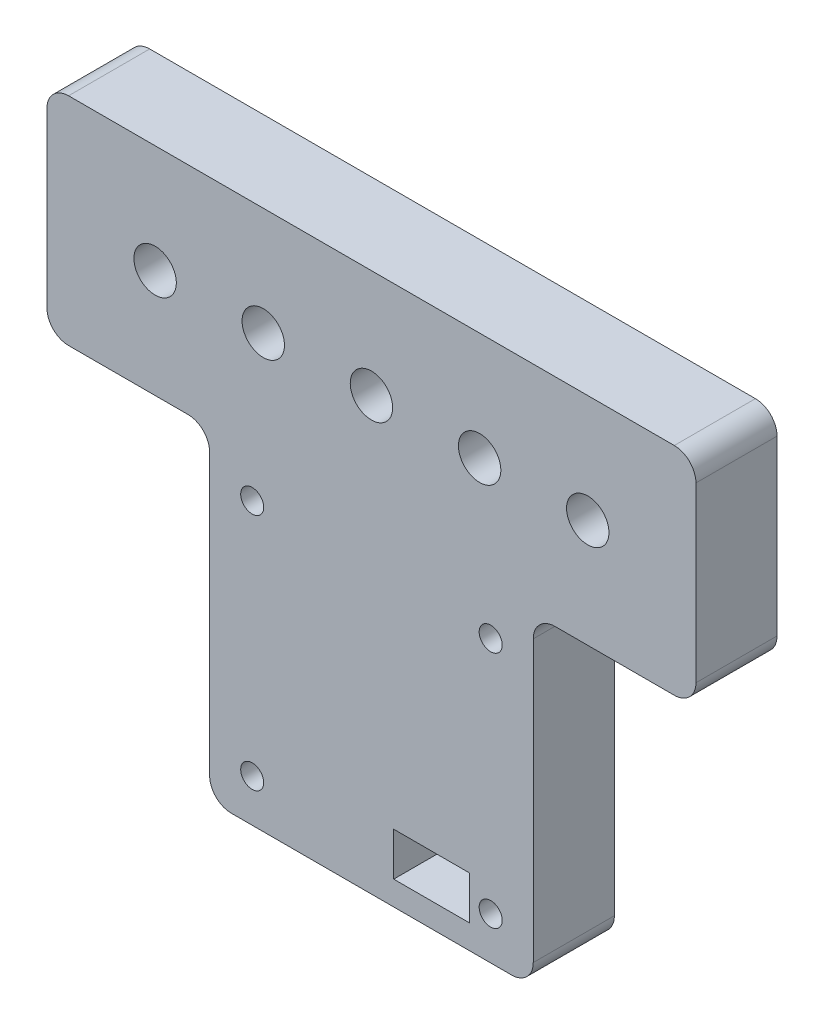
from build123d import *

# Parameters (mm, degrees)
SKETCH1_W                    = 38
SKETCH1_H                    = 38
BOSS_EXTRUDE1_DEPTH          = 9.525
F_36_0_1065_DIAMETER_HOLE2_D = 2.7051
SKETCH7_W                    = 8.89
SKETCH7_H                    = 5.08
CUT_EXTRUDE1_DEPTH           = 29.508343077
SKETCH8_W                    = 76.2
SKETCH8_H                    = 9.525
BOSS_EXTRUDE2_DEPTH          = 25.4
F_9_0_196_DIAMETER_HOLE1_D   = 4.9784
FILLET1_R                    = 2.54


with BuildPart() as part:
    # Sketch1 → Boss-Extrude1 (new body)
    with BuildSketch(Plane(origin=(0, 0, 0), x_dir=(0, 1, 0), z_dir=(0, 0, 1))):
        Rectangle(SKETCH1_W, SKETCH1_H)
    extrude(amount=BOSS_EXTRUDE1_DEPTH)

    # #36 (0.1065) Diameter Hole2 (through all)
    with Locations(Plane.XY.offset(9.525)):
        with Locations((-14, -14), (14, -14), (14, 14), (-14, 14)):
            Hole(F_36_0_1065_DIAMETER_HOLE2_D / 2)

    # Sketch7 → Cut-Extrude1 (cut, through all)
    with BuildSketch(Plane(origin=(0, 0, 0), x_dir=(1, 0, 0), z_dir=(0, 0, -1))):
        with Locations((7.05999991, 13.629999978)):
            Rectangle(SKETCH7_W, SKETCH7_H)
    extrude(amount=-CUT_EXTRUDE1_DEPTH, mode=Mode.SUBTRACT)

    # Sketch8 → Boss-Extrude2 (add)
    with BuildSketch(Plane(origin=(0, 19, 0), x_dir=(-1, 0, 0), z_dir=(0, 1, 0))):
        with Locations((0, 4.7625)):
            Rectangle(SKETCH8_W, SKETCH8_H)
    extrude(amount=BOSS_EXTRUDE2_DEPTH)

    # #9 (0.196) Diameter Hole1 (through all)
    with Locations(Plane(origin=(0, 0, 0), x_dir=(1, 0, 0), z_dir=(0, 0, -1))):
        with Locations((-25.4, -31.7), (-12.7, -31.7), (0, -31.7), (12.7, -31.7), (25.4, -31.7)):
            Hole(F_9_0_196_DIAMETER_HOLE1_D / 2)

    # Fillet1
    fillet1_edges = [part.edges().sort_by_distance(p)[0] for p in [
        (-38.1, 19, 4.7625),
        (38.1, 19, 4.7625),
        (-38.1, 44.4, 4.7625),
        (38.1, 44.4, 4.7625),
        (19, 19, 4.7625),
        (19, -19, 4.7625),
        (-19, -19, 4.7625),
        (-19, 19, 4.7625),
    ]]
    fillet(fillet1_edges, radius=FILLET1_R)


solid = part.part
